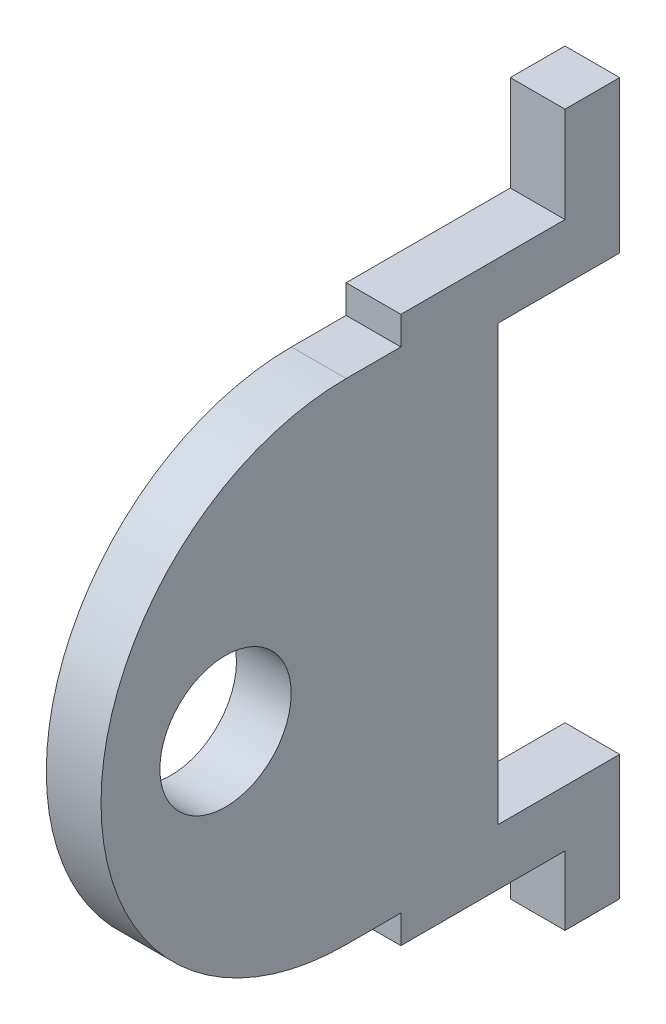
from build123d import *

# Parameters (mm, degrees)
BOSS_EXTRUDE1_DEPTH = 1.5875
BOSS_EXTRUDE2_DEPTH = 1.5875
SKETCH5_R           = 3.81
CUT_EXTRUDE1_DEPTH  = 3.175


with BuildPart() as part:
    # Sketch3 → Boss-Extrude1 (new, symmetric)
    with BuildSketch(Plane.YZ):
        Polygon((-19.8628, 0), (-19.8628, 3.175), (-15.86484, 3.175), (-15.86484, 12.7), (15.86484, 12.7), (15.86484, 3.175), (21.4122, 3.175), (21.4122, 0), (12.5984, 0), (12.5984, 7.0612), (-12.5984, 7.0612), (-12.5984, 0), align=None)
    extrude(amount=BOSS_EXTRUDE1_DEPTH, both=True)

    # Sketch4 → Boss-Extrude2 (add, symmetric)
    with BuildSketch(Plane.YZ):
        with BuildLine():
            Line((-14.224, 12.7), (-14.224, 15.875))
            ThreePointArc((-14.224, 15.875), (0, 30.099), (14.224, 15.875))
            Line((14.224, 15.875), (14.224, 12.7))
            Line((14.224, 12.7), (15.86484, 12.7))
            Line((15.86484, 12.7), (15.86484, 3.175))
            Line((15.86484, 3.175), (21.4122, 3.175))
            Line((21.4122, 3.175), (21.4122, 0))
            Line((21.4122, 0), (12.5984, 0))
            Line((12.5984, 0), (12.5984, 7.0612))
            Line((12.5984, 7.0612), (-12.5984, 7.0612))
            Line((-12.5984, 7.0612), (-12.5984, 0))
            Line((-12.5984, 0), (-19.8628, 0))
            Line((-19.8628, 0), (-19.8628, 3.175))
            Line((-19.8628, 3.175), (-15.86484, 3.175))
            Line((-15.86484, 3.175), (-15.86484, 12.7))
            Line((-15.86484, 12.7), (-14.224, 12.7))
        make_face()
    extrude(amount=BOSS_EXTRUDE2_DEPTH, both=True)

    # Sketch5 → Cut-Extrude1 (cut)
    with BuildSketch(Plane.YZ.offset(1.5875)):
        with Locations(Location((0, 22.873624204, 0), (0, 0, 270))):
            Circle(SKETCH5_R)
    extrude(amount=-CUT_EXTRUDE1_DEPTH, mode=Mode.SUBTRACT)


solid = part.part
